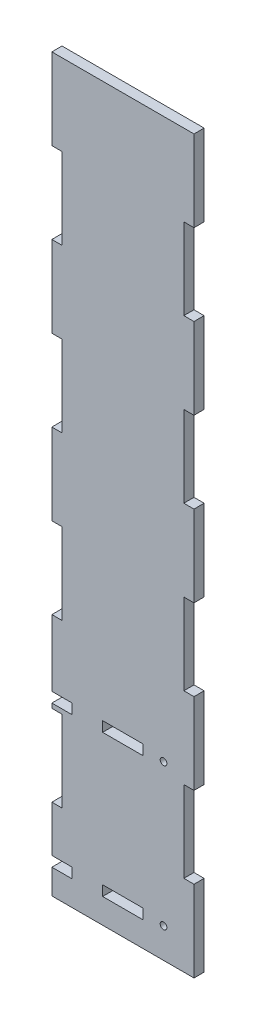
from build123d import *

# Parameters (mm, degrees)
SKETCH2_W           = 6.35
SKETCH2_H           = 88.9
BOSS_EXTRUDE1_DEPTH = 457.2
SKETCH4_W           = 6.35
SKETCH4_H           = 50.8
CUT_EXTRUDE1_DEPTH  = 460.399570091
SKETCH5_W           = 12.7
SKETCH5_H           = 6.35
CUT_EXTRUDE2_DEPTH  = 460.399570091
SKETCH6_R           = 2.0955
CUT_EXTRUDE3_DEPTH  = 460.399570091
SKETCH7_W           = 12.7
SKETCH7_H           = 6.35
CUT_EXTRUDE4_DEPTH  = 10
SKETCH8_W           = 12.7
SKETCH8_H           = 6.35
CUT_EXTRUDE5_DEPTH  = 460.399570091


with BuildPart() as part:
    # Sketch2 → Boss-Extrude1 (new body)
    with BuildSketch(Plane.ZX):
        with Locations((41.275, 0)):
            Rectangle(SKETCH2_W, SKETCH2_H)
    extrude(amount=BOSS_EXTRUDE1_DEPTH)

    # Sketch4 → Cut-Extrude1 (cut, through all)
    with BuildSketch(Plane.XY.offset(44.45)):
        with Locations((41.275, 381)):
            Rectangle(SKETCH4_W, SKETCH4_H)
        with Locations((41.275, 279.4)):
            Rectangle(SKETCH4_W, SKETCH4_H)
        with Locations((41.275, 177.8)):
            Rectangle(SKETCH4_W, SKETCH4_H)
        with Locations((41.275, 76.2)):
            Rectangle(SKETCH4_W, SKETCH4_H)
    cut_extrude1 = extrude(amount=-CUT_EXTRUDE1_DEPTH, mode=Mode.SUBTRACT)

    # Mirror1: Cut-Extrude1 across plane
    add(cut_extrude1.mirror(Plane(origin=(0, 0, 0), x_dir=(0, 0, 1), z_dir=(1, 0, 0))), mode=Mode.SUBTRACT)

    # Sketch5 → Cut-Extrude2 (cut, through all)
    with BuildSketch(Plane(origin=(0, 0, 38.1), x_dir=(-1, 0, 0), z_dir=(0, 0, -1))):
        with Locations((6.35, 18.7625)):
            Rectangle(SKETCH5_W, SKETCH5_H)
        with Locations((-6.35, 18.7625)):
            Rectangle(SKETCH5_W, SKETCH5_H)
        with Locations((6.35, 107.6625)):
            Rectangle(SKETCH5_W, SKETCH5_H)
        with Locations((-6.35, 107.6625)):
            Rectangle(SKETCH5_W, SKETCH5_H)
    extrude(amount=-CUT_EXTRUDE2_DEPTH, mode=Mode.SUBTRACT)

    # Sketch6 → Cut-Extrude3 (cut, through all)
    with BuildSketch(Plane.XY.offset(44.45)):
        with Locations((25.4, 107.6625)):
            Circle(SKETCH6_R)
        with Locations((25.4, 18.7625)):
            Circle(SKETCH6_R)
    extrude(amount=-CUT_EXTRUDE3_DEPTH, mode=Mode.SUBTRACT)

    # Sketch7 → Cut-Extrude4 (cut)
    with BuildSketch(Plane(origin=(0, 0, 38.1), x_dir=(-1, 0, 0), z_dir=(0, 0, -1))):
        with Locations((38.1, 107.6625)):
            Rectangle(SKETCH7_W, SKETCH7_H)
    extrude(amount=-CUT_EXTRUDE4_DEPTH, mode=Mode.SUBTRACT)

    # Sketch8 → Cut-Extrude5 (cut, through all)
    with BuildSketch(Plane(origin=(0, 0, 38.1), x_dir=(-1, 0, 0), z_dir=(0, 0, -1))):
        with Locations((38.1, 18.7625)):
            Rectangle(SKETCH8_W, SKETCH8_H)
    extrude(amount=-CUT_EXTRUDE5_DEPTH, mode=Mode.SUBTRACT)


solid = part.part
